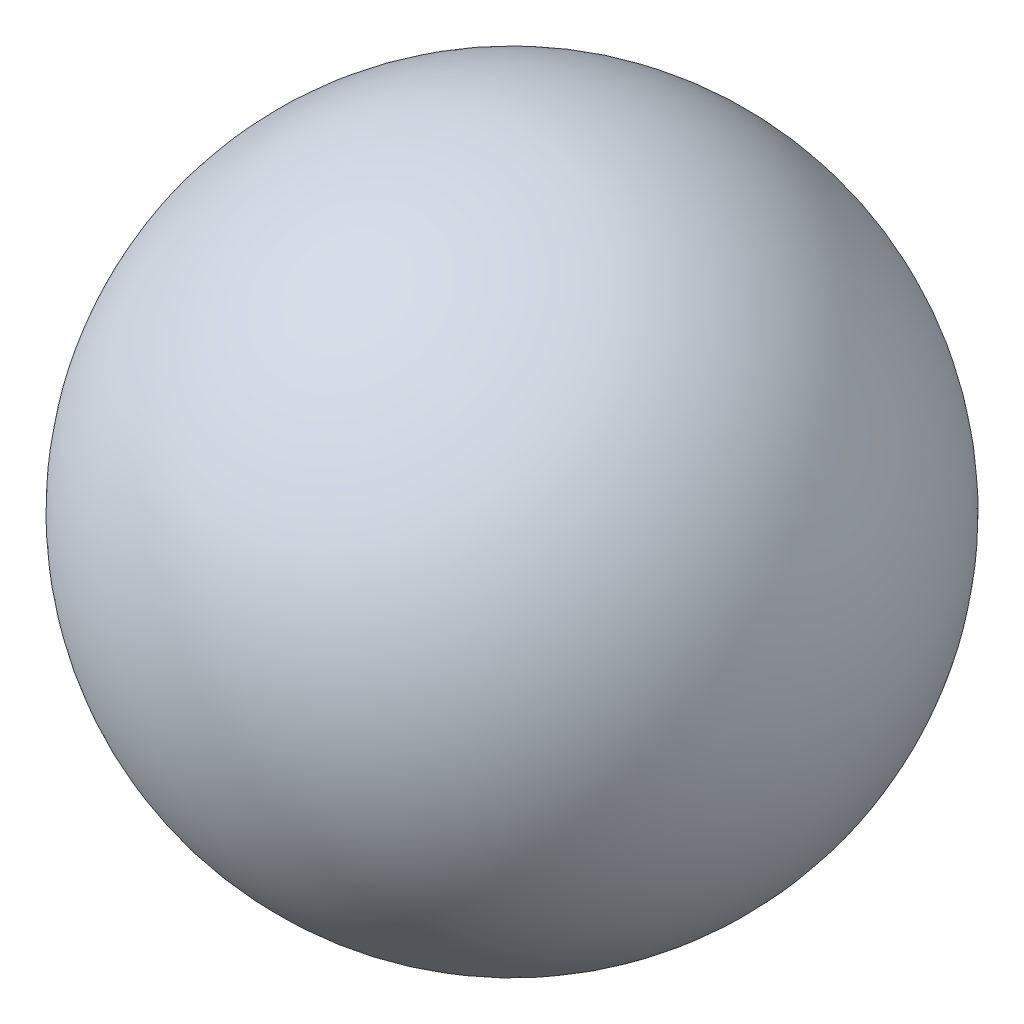
from build123d import *


with BuildPart() as part:
    # Croquis1 → Revolución4 (revolve)
    with BuildSketch(Plane(origin=(0, 0, 0), x_dir=(1, 0, 0), z_dir=(0, 1, 0))):
        with BuildLine():
            Line((8, 0), (-8, 0))
            ThreePointArc((-8, 0), (0, 8), (8, 0))
        make_face()
    revolve(axis=Axis((-8, 0, 0), (1, 0, 0)))


solid = part.part
